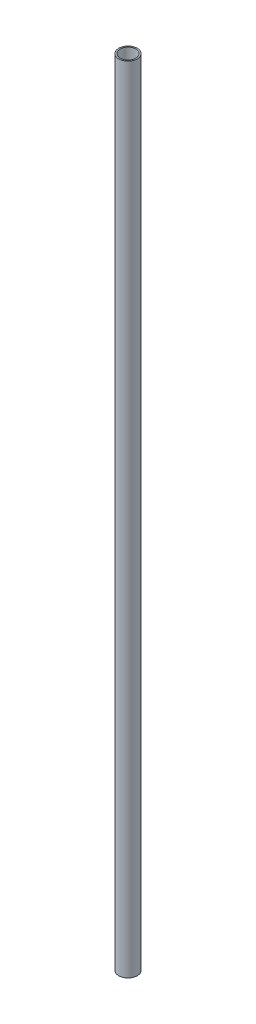
from build123d import *

# Parameters (mm, degrees)
SKETCH1_R           = 7
SKETCH1_R_2         = 6
BOSS_EXTRUDE1_DEPTH = 600


with BuildPart() as part:
    # Sketch1 → Boss-Extrude1 (new body)
    with BuildSketch(Plane(origin=(0, 0, 0), x_dir=(1, 0, 0), z_dir=(0, 1, 0))):
        with Locations(Location((0, 0, 0), (0, 0, 270))):
            Circle(SKETCH1_R)
        with Locations(Location((0, 0, 0), (0, 0, 270))):
            Circle(SKETCH1_R_2, mode=Mode.SUBTRACT)
    extrude(amount=BOSS_EXTRUDE1_DEPTH)


solid = part.part
